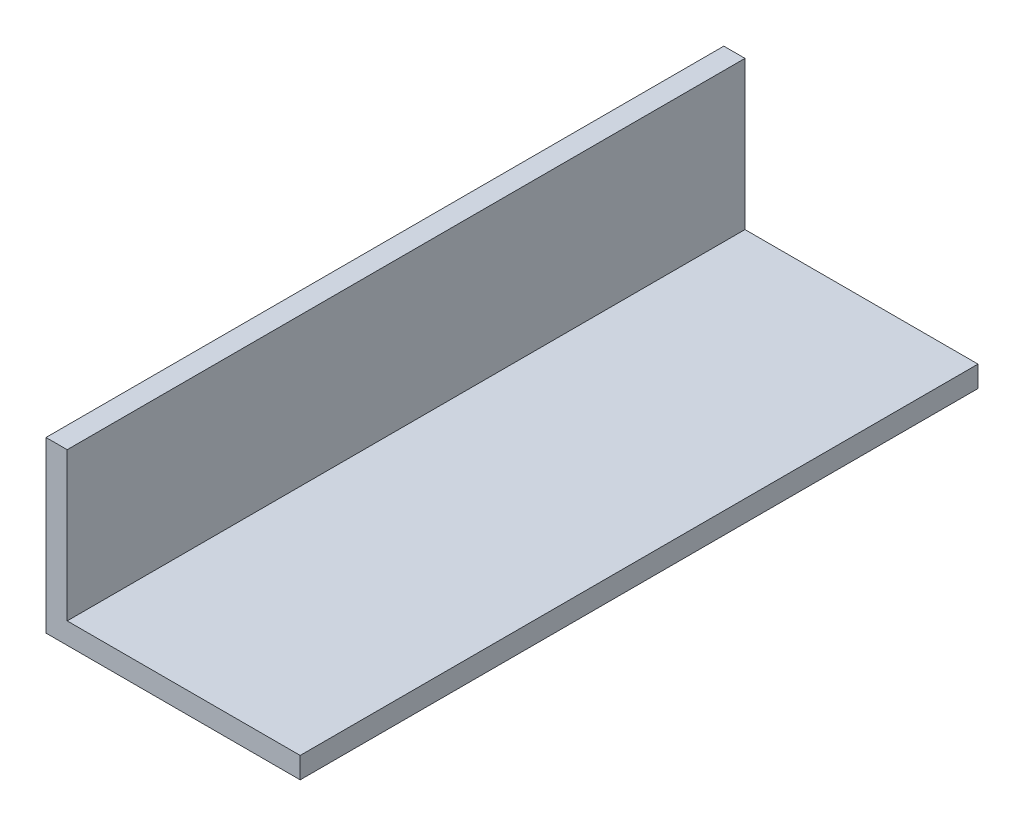
from build123d import *

# Parameters (mm, degrees)
BOSS_EXTRUDE1_DEPTH = 50.8


with BuildPart() as part:
    # Sketch3 → Boss-Extrude1 (new body)
    with BuildSketch(Plane.XY):
        Polygon((0, 0), (19.05, 0), (19.05, 1.5875), (1.5875, 1.5875), (1.5875, 12.7), (0, 12.7), align=None)
    extrude(amount=BOSS_EXTRUDE1_DEPTH)


solid = part.part
